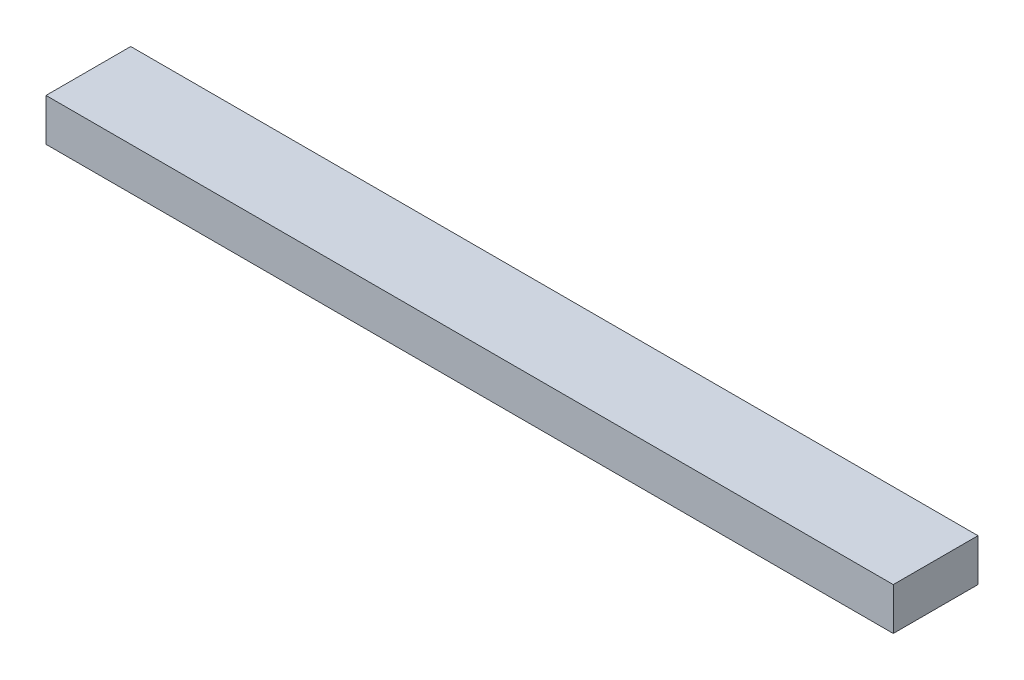
from build123d import *

# Parameters (mm, degrees)
SKETCH1_W           = 254
SKETCH1_H           = 25.4
BOSS_EXTRUDE1_DEPTH = 12.7


with BuildPart() as part:
    # Sketch1 → Boss-Extrude1 (new body)
    with BuildSketch(Plane(origin=(0, 0, 0), x_dir=(1, 0, 0), z_dir=(0, 1, 0))):
        with Locations((127, 12.7)):
            Rectangle(SKETCH1_W, SKETCH1_H)
    extrude(amount=BOSS_EXTRUDE1_DEPTH)


solid = part.part
